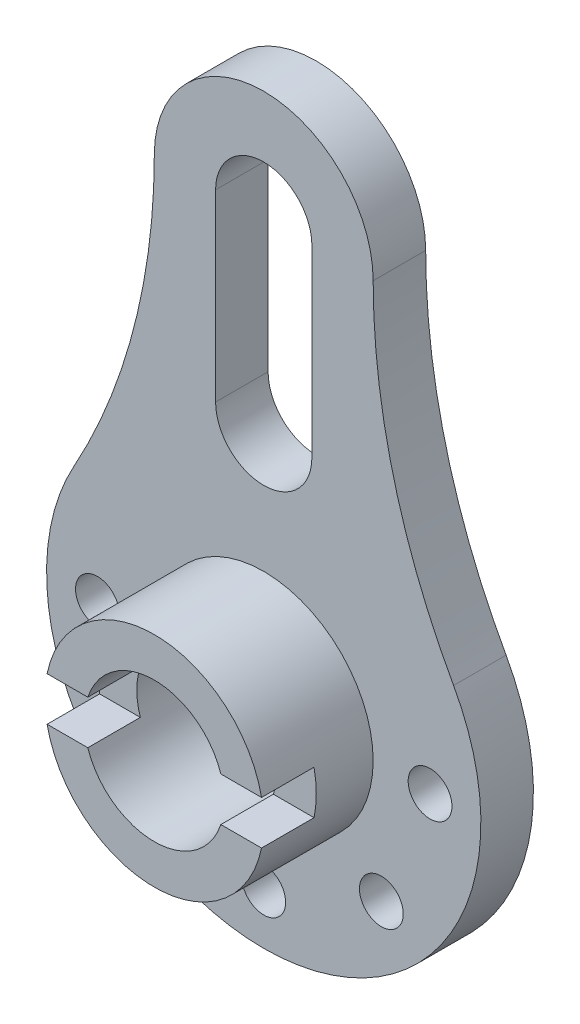
from build123d import *

# Parameters (mm, degrees)
EXTRUDE_1_DEPTH     = 12
SKETCH_2_R          = 5
CUT_EXTRUDE_1_DEPTH = 131.40645681
SKETCH_3_R          = 25
EXTRUDE_2_DEPTH     = 25
SKETCH_4_R          = 16
CUT_EXTRUDE_2_DEPTH = 136.021642627
CUT_EXTRUDE_3_DEPTH = 12


with BuildPart() as part:
    # 草圖1 → 填料-伸長1 (new body)
    with BuildSketch(Plane.XY):
        with BuildLine():
            ThreePointArc((25, 95), (0, 120), (-25, 95))
            ThreePointArc((-25, 95), (-29.667879628, 58.377168991), (-43.373037686, 24.096132048))
            ThreePointArc((-43.373037686, 24.096132048), (0, -49.616972679), (43.373037686, 24.096132048))
            ThreePointArc((43.373037686, 24.096132048), (29.667879628, 58.377168991), (25, 95))
        make_face()
        with BuildLine():
            Line((-11, 95), (-11, 53))
            ThreePointArc((-11, 53), (0, 42), (11, 53))
            Line((11, 53), (11, 95))
            ThreePointArc((11, 95), (0, 106), (-11, 95))
        make_face(mode=Mode.SUBTRACT)
    extrude(amount=EXTRUDE_1_DEPTH)

    # 草圖2 → 除料-伸長1 (cut, through all)
    with BuildSketch(Plane.XY.offset(12)):
        with Locations((38, 0)):
            Circle(SKETCH_2_R)
        with Locations((-38, 0)):
            Circle(SKETCH_2_R)
        with Locations((-26.870057685, -26.870057685)):
            Circle(SKETCH_2_R)
        with Locations((0, -38)):
            Circle(SKETCH_2_R)
        with Locations((26.870057685, -26.870057685)):
            Circle(SKETCH_2_R)
    extrude(amount=-CUT_EXTRUDE_1_DEPTH, mode=Mode.SUBTRACT)

    # 草圖3 → 填料-伸長2 (add)
    with BuildSketch(Plane.XY.offset(12)):
        Circle(SKETCH_3_R)
    extrude(amount=EXTRUDE_2_DEPTH)

    # 草圖4 → 除料-伸長2 (cut, through all)
    with BuildSketch(Plane.XY.offset(37)):
        Circle(SKETCH_4_R)
    extrude(amount=-CUT_EXTRUDE_2_DEPTH, mode=Mode.SUBTRACT)

    # 草圖5 → 除料-伸長3 (cut)
    with BuildSketch(Plane.XY.offset(37)):
        with BuildLine():
            Line((-24.494897428, 5), (-15.198684154, 5))
            ThreePointArc((-15.198684154, 5), (-16, 0), (-15.198684154, -5))
            Line((-15.198684154, -5), (-24.494897428, -5))
            ThreePointArc((-24.494897428, -5), (-25, 0), (-24.494897428, 5))
        make_face()
        with BuildLine():
            Line((15.198684154, -5), (24.494897428, -5))
            ThreePointArc((24.494897428, -5), (25, 0), (24.494897428, 5))
            Line((24.494897428, 5), (15.198684154, 5))
            ThreePointArc((15.198684154, 5), (16, 0), (15.198684154, -5))
        make_face()
    extrude(amount=-CUT_EXTRUDE_3_DEPTH, mode=Mode.SUBTRACT)


solid = part.part
